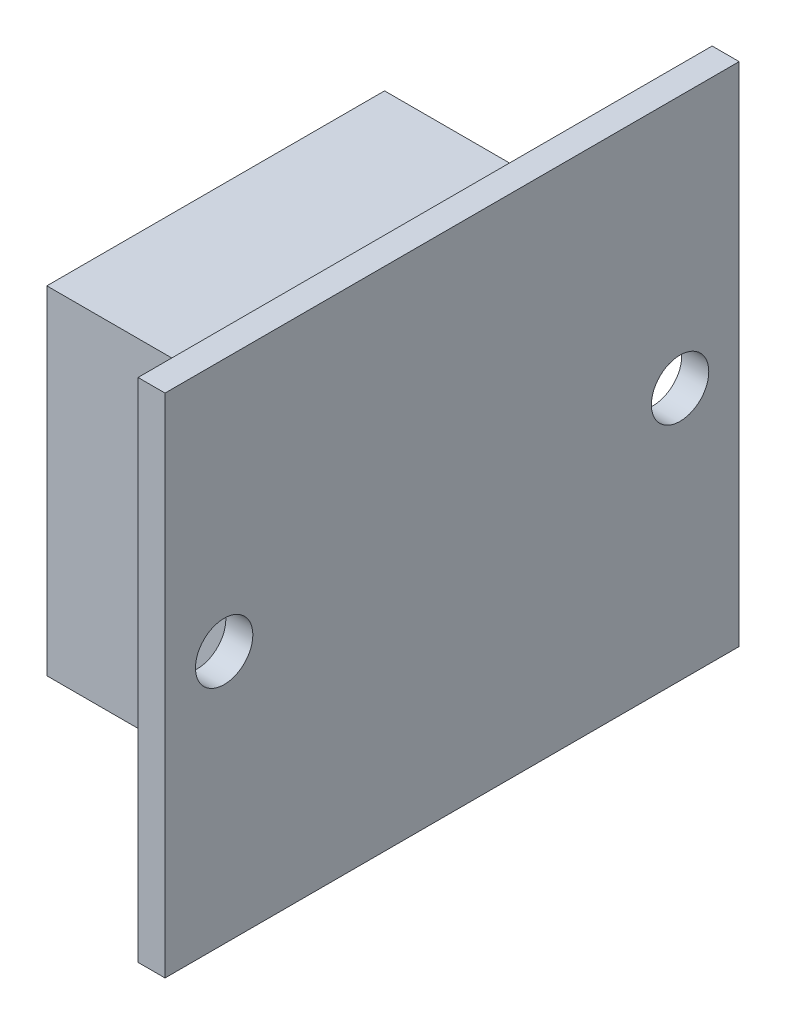
from build123d import *

# Parameters (mm, degrees)
PLATE_START              = -91.6
PLATE_SKETCH_W           = 34
PLATE_SKETCH_H           = 30
PLATE_SKETCH_R           = 1.7
PLATE_DEPTH              = 1.6
MATEK_START              = -93.2
MATEK_M10Q_5883_SKETCH_W = 20
MATEK_M10Q_5883_SKETCH_H = 20
MATEK_M10Q_5883_DEPTH    = 12.4


with BuildPart() as part:
    # Plate Sketch → Plate (new body)
    with BuildSketch(Plane(origin=(0, 0, 0), x_dir=(0, 0, -1), z_dir=(1, 0, 0)).offset(PLATE_START)):
        with Locations((0, -45)):
            Rectangle(PLATE_SKETCH_W, PLATE_SKETCH_H)
        with Locations((13.5, -45)):
            Circle(PLATE_SKETCH_R, mode=Mode.SUBTRACT)
        with Locations((-13.5, -45)):
            Circle(PLATE_SKETCH_R, mode=Mode.SUBTRACT)
    extrude(amount=-PLATE_DEPTH)

    # Matek M10Q-5883 Sketch → Matek M10Q-5883 (add)
    with BuildSketch(Plane(origin=(0, 0, 0), x_dir=(0, 0, -1), z_dir=(1, 0, 0)).offset(MATEK_START)):
        with Locations((0, -45)):
            Rectangle(MATEK_M10Q_5883_SKETCH_W, MATEK_M10Q_5883_SKETCH_H)
    extrude(amount=-MATEK_M10Q_5883_DEPTH)


solid = part.part
